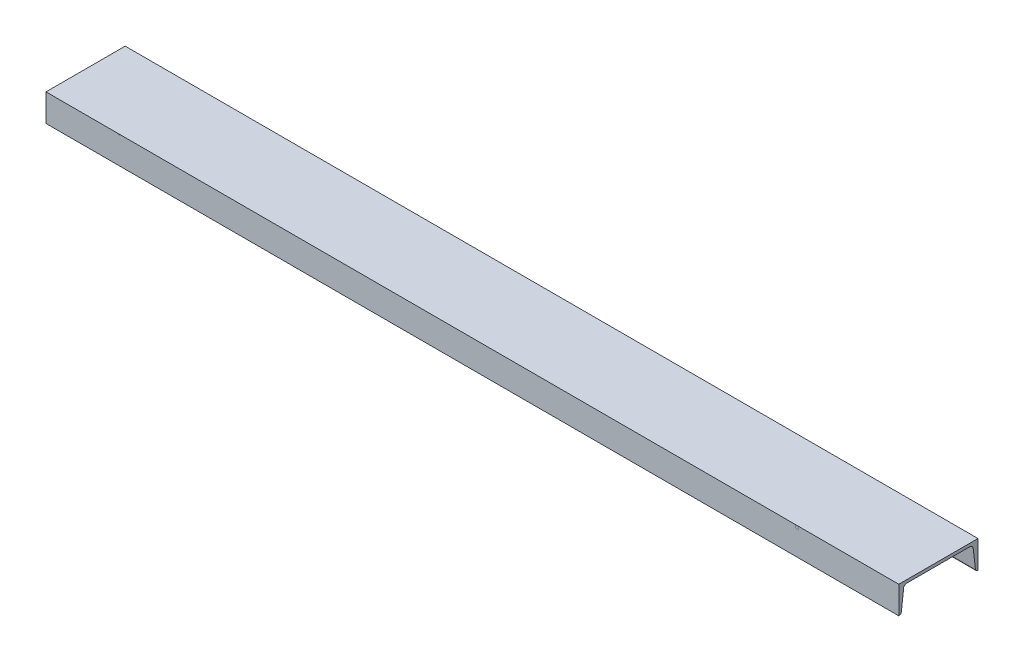
from build123d import *

# Parameters (mm, degrees)
EXTRUDE_1_DEPTH     = 2800
SKETCH_3_W          = 3.411754403
SKETCH_3_H          = 3.411754404
CUT_EXTRUDE_1_DEPTH = 0.01
SKETCH_4_W          = 10
SKETCH_4_H          = 10
EXTRUDE_2_DEPTH     = 0.01
SKETCH_4_2_W        = 10
SKETCH_4_2_H        = 10
CUT_EXTRUDE_2_DEPTH = 0.01


with BuildPart() as part:
    # Эскиз2 → Бобышка-Вытянуть1 (new body)
    with BuildSketch(Plane(origin=(0, 0, 0), x_dir=(0, 0, -1), z_dir=(1, 0, 0))):
        with BuildLine():
            Line((130, 0), (-130, 0))
            Line((-130, 0), (-130, -90))
            Line((-130, -90), (-128.678333405, -90))
            ThreePointArc((-128.678333405, -90), (-124.028136062, -88.232175902), (-121.726718983, -83.821618477))
            Line((-121.726718983, -83.821618477), (-113.795983048, -16.720622289))
            ThreePointArc((-113.795983048, -16.720622289), (-108.696165424, -11.795261413), (-101.83727659, -10))
            Line((-101.83727659, -10), (101.83727659, -10))
            ThreePointArc((101.83727659, -10), (108.696165424, -11.795261413), (113.795983048, -16.720622289))
            Line((113.795983048, -16.720622289), (121.726718983, -83.821618477))
            ThreePointArc((121.726718983, -83.821618477), (124.028136062, -88.232175902), (128.678333405, -90))
            Line((128.678333405, -90), (130, -90))
            Line((130, -90), (130, 0))
        make_face()
    extrude(amount=EXTRUDE_1_DEPTH)

    # Эскиз3 → Вырез-Вытянуть1 (cut)
    with BuildSketch(Plane.XY.offset(130)):
        with Locations((239.670222602, -1.705877202)):
            Rectangle(SKETCH_3_W, SKETCH_3_H)
    extrude(amount=-CUT_EXTRUDE_1_DEPTH, mode=Mode.SUBTRACT)

    # Эскиз4 → Бобышка-Вытянуть2 (add)
    with BuildSketch(Plane.XY.offset(130)):
        with Locations((2465, -5)):
            Rectangle(SKETCH_4_W, SKETCH_4_H)
    extrude(amount=-EXTRUDE_2_DEPTH)

    # Эскиз4<2> → Вырез-Вытянуть2 (cut)
    with BuildSketch(Plane.XY.offset(130)):
        with Locations((2465, -5)):
            Rectangle(SKETCH_4_2_W, SKETCH_4_2_H)
    extrude(amount=-CUT_EXTRUDE_2_DEPTH, mode=Mode.SUBTRACT)


solid = part.part
